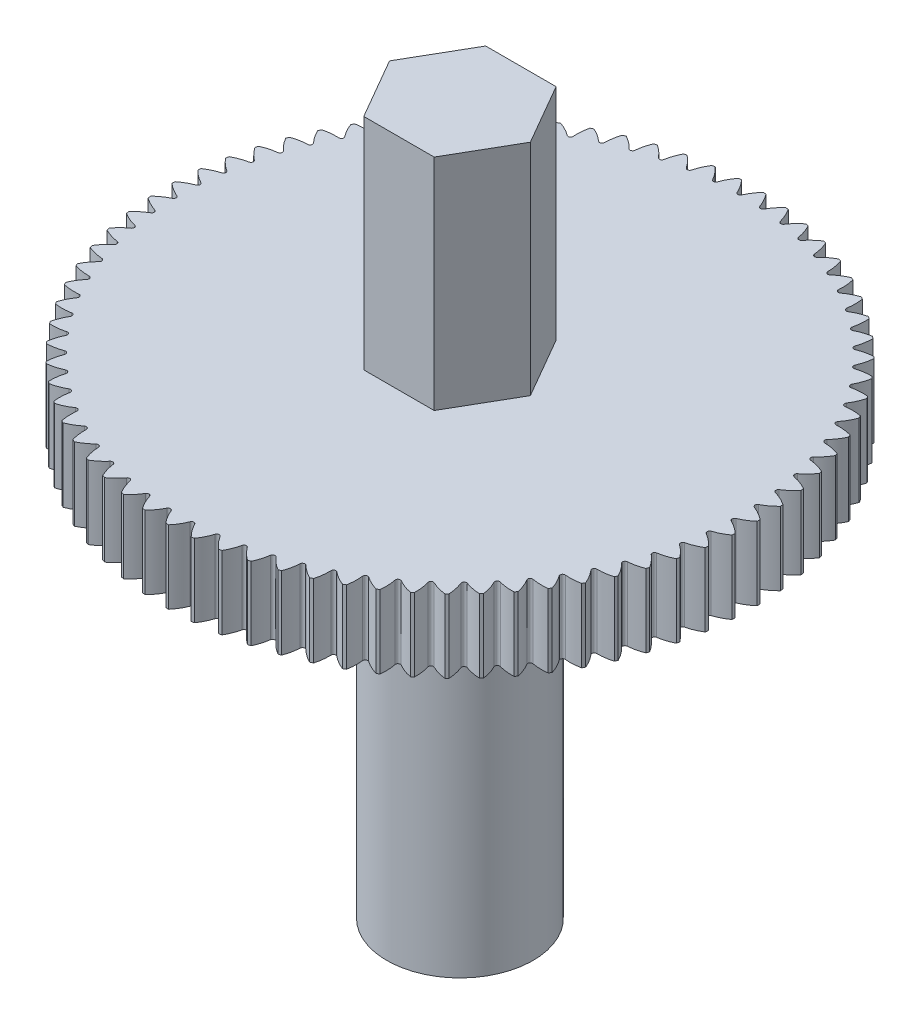
from build123d import *

# Parameters (mm, degrees)
CUT_EXTRUDE_1_DEPTH      = 10
PATTERN_CIRCULAR_1_COUNT = 75
CUT_EXTRUDE_START        = -9
SKETCH_3_R               = 3
CUT_EXTRUDE_2_DEPTH      = 9


with BuildPart() as part:
    # 草图1 → 旋转1 (revolve)
    with BuildSketch(Plane.XY, mode=Mode.PRIVATE) as revolve_1_sk:
        Polygon((0, 0), (0, 29), (3, 29), (3, 20), (12, 20), (12, 17), (3, 17), (3, 0), align=None)
    revolve(revolve_1_sk.sketch.rotate(Axis((0, 0, 0), (0, 1, 0)), 90), axis=Axis((0, 0, 0), (0, 1, 0)))

    # 草图2 → 切除-拉伸1 (cut)
    with BuildSketch(Plane(origin=(0, 20, 0), x_dir=(1, 0, 0), z_dir=(0, 1, 0))):
        with BuildLine():
            Line((-0.45, 12), (0.45, 12))
            ThreePointArc((0.45, 12), (0.248504486, 11.744148972), (0.091203345, 11.458988418))
            ThreePointArc((0.091203345, 11.458988418), (0, 11.4), (-0.091203345, 11.458988418))
            ThreePointArc((-0.091203345, 11.458988418), (-0.248504486, 11.744148972), (-0.45, 12))
        make_face()
    cut_extrude_1 = extrude(amount=-CUT_EXTRUDE_1_DEPTH, mode=Mode.SUBTRACT)

    # 阵列(圆周)1: 切除-拉伸1 ×75 about axis
    pattern_circular_1_axis = Axis((0, 0, 0), (0, 1, 0))
    for i in range(1, PATTERN_CIRCULAR_1_COUNT):
        add(cut_extrude_1.rotate(pattern_circular_1_axis, i * 360 / PATTERN_CIRCULAR_1_COUNT), mode=Mode.SUBTRACT)

    # 草图3 → 切除-拉伸2 (cut)
    with BuildSketch(Plane(origin=(0, 29, 0), x_dir=(1, 0, 0), z_dir=(0, 1, 0)).offset(CUT_EXTRUDE_START)):
        with Locations(Location((0, 0, 0), (0, 0, 90))):
            Circle(SKETCH_3_R)
        Polygon((2.886751346, 0), (1.443375673, 2.5), (-1.443375673, 2.5), (-2.886751346, 0), (-1.443375673, -2.5), (1.443375673, -2.5), align=None, mode=Mode.SUBTRACT)
    extrude(amount=CUT_EXTRUDE_2_DEPTH, mode=Mode.SUBTRACT)


solid = part.part
